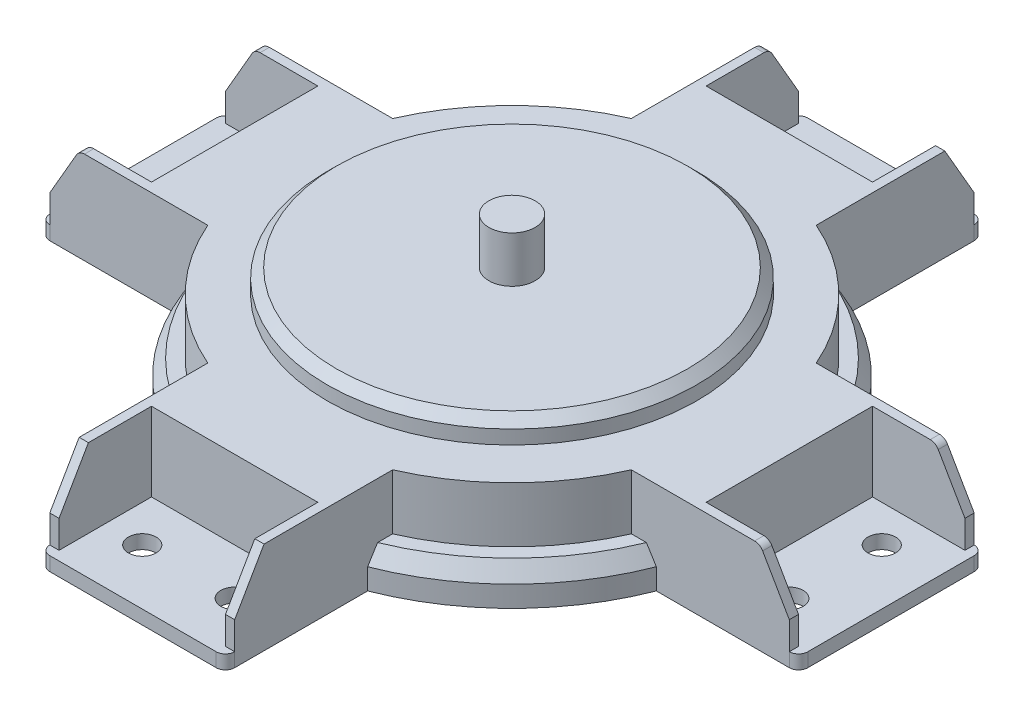
from build123d import *
from OCP.BRepFilletAPI import BRepFilletAPI_MakeChamfer

# Parameters (mm, degrees)
SKETCH5_R            = 250
BOSS_EXTRUDE4_DEPTH  = 100
SKETCH6_W            = 200
SKETCH6_H            = 100
SKETCH6_W_2          = 100
SKETCH6_H_2          = 200
BOSS_EXTRUDE5_DEPTH  = 100
BOSS_EXTRUDE6_DEPTH  = 15
BOSS_EXTRUDE7_DEPTH  = 10
BOSS_EXTRUDE8_DEPTH  = 10
SKETCH18_R           = 15
CUT_EXTRUDE2_DEPTH   = 587.024743505
BOSS_EXTRUDE9_DEPTH  = 10
BOSS_EXTRUDE10_START = -10
BOSS_EXTRUDE10_DEPTH = 10
BOSS_EXTRUDE11_DEPTH = 10
BOSS_EXTRUDE12_DEPTH = 10
SKETCH24_R           = 200
BOSS_EXTRUDE13_DEPTH = 25
SKETCH25_R           = 25
BOSS_EXTRUDE14_DEPTH = 50
BOSS_EXTRUDE15_DEPTH = 40
CHAMFER1_SIZE        = 10
CHAMFER1_SIZE2       = 17.320508076
CHAMFER2_SIZE        = 10


with BuildPart() as part:
    # Sketch5 → Boss-Extrude4 (new body)
    with BuildSketch(Plane(origin=(0, 0, 0), x_dir=(1, 0, 0), z_dir=(0, 1, 0))):
        with Locations(Location((0, 0, 0), (0, 0, 270))):
            Circle(SKETCH5_R)
    extrude(amount=BOSS_EXTRUDE4_DEPTH)

    # Sketch6 → Boss-Extrude5 (add)
    with BuildSketch(Plane(origin=(0, 100, 0), x_dir=(1, 0, 0), z_dir=(0, 1, 0))):
        with Locations((0, -250)):
            Rectangle(SKETCH6_W, SKETCH6_H)
        with Locations((0, 250)):
            Rectangle(SKETCH6_W, SKETCH6_H)
        with Locations((250, 0)):
            Rectangle(SKETCH6_W_2, SKETCH6_H_2)
        with Locations((-250, 0)):
            Rectangle(SKETCH6_W_2, SKETCH6_H_2)
    extrude(amount=-BOSS_EXTRUDE5_DEPTH)

    # Sketch10 → Boss-Extrude6 (add)
    with BuildSketch(Plane.XZ):
        with BuildLine():
            Line((-100, 300), (-100, 400))
            ThreePointArc((-100, 400), (-97.071067812, 407.071067812), (-90, 410))
            Line((-90, 410), (90, 410))
            ThreePointArc((90, 410), (97.071067812, 407.071067812), (100, 400))
            Line((100, 400), (100, 300))
            Line((100, 300), (-100, 300))
        make_face()
        with BuildLine():
            Line((100, -310), (100, -400))
            ThreePointArc((100, -400), (97.071067812, -407.071067812), (90, -410))
            Line((90, -410), (-90, -410))
            ThreePointArc((-90, -410), (-97.071067812, -407.071067812), (-100, -400))
            Line((-100, -400), (-100, -300))
            Line((-100, -300), (90, -300))
            Line((90, -300), (100, -300))
            Line((100, -300), (100, -310))
        make_face()
        with BuildLine():
            Line((-300, -100), (-400, -100))
            ThreePointArc((-400, -100), (-407.071067812, -97.071067812), (-410, -90))
            Line((-410, -90), (-410, 90))
            ThreePointArc((-410, 90), (-407.071067812, 97.071067812), (-400, 100))
            Line((-400, 100), (-300, 100))
            Line((-300, 100), (-300, -100))
        make_face()
        with BuildLine():
            Line((300, -100), (400, -100))
            ThreePointArc((400, -100), (407.071067812, -97.071067812), (410, -90))
            Line((410, -90), (410, 90))
            ThreePointArc((410, 90), (407.071067812, 97.071067812), (400, 100))
            Line((400, 100), (300, 100))
            Line((300, 100), (300, -100))
        make_face()
    extrude(amount=-BOSS_EXTRUDE6_DEPTH)

    # Sketch12 → Boss-Extrude7 (add)
    with BuildSketch(Plane(origin=(100, 0, 0), x_dir=(0, 0, -1), z_dir=(1, 0, 0))):
        Polygon((-400, 15), (-400, 45), (-368.245735195, 100), (-300, 100), (-300, 15), align=None)
    extrude(amount=-BOSS_EXTRUDE7_DEPTH)

    # Sketch13 → Boss-Extrude8 (add)
    with BuildSketch(Plane.ZY.offset(100)):
        Polygon((300, 100), (300, 15), (400, 15), (400, 45), (368.245735195, 100), align=None)
    extrude(amount=-BOSS_EXTRUDE8_DEPTH)

    # Sketch18 → Cut-Extrude2 (cut, through all)
    with BuildSketch(Plane(origin=(0, 15, 0), x_dir=(1, 0, 0), z_dir=(0, 1, 0))):
        with Locations(Location((-50, -350, 0), (0, 0, 270))):
            Circle(SKETCH18_R)
        with Locations(Location((50, -350, 0), (0, 0, 270))):
            Circle(SKETCH18_R)
        with Locations(Location((-350, 50, 0), (0, 0, 270))):
            Circle(SKETCH18_R)
        with Locations(Location((-350, -50, 0), (0, 0, 270))):
            Circle(SKETCH18_R)
        with Locations(Location((-50, 350, 0), (0, 0, 270))):
            Circle(SKETCH18_R)
        with Locations(Location((50, 350, 0), (0, 0, 270))):
            Circle(SKETCH18_R)
        with Locations(Location((350, 50, 0), (0, 0, 270))):
            Circle(SKETCH18_R)
        with Locations(Location((350, -50, 0), (0, 0, 270))):
            Circle(SKETCH18_R)
    extrude(amount=-CUT_EXTRUDE2_DEPTH, mode=Mode.SUBTRACT)

    # Sketch19 → Boss-Extrude9 (add)
    with BuildSketch(Plane.XY.offset(100)):
        with BuildLine():
            Line((-400, 15), (-400, 45))
            Line((-400, 45), (-371.132486541, 95))
            ThreePointArc((-371.132486541, 95), (-367.472232503, 98.660254038), (-362.472232503, 100))
            Line((-362.472232503, 100), (-300, 100))
            Line((-300, 100), (-300, 15))
            Line((-300, 15), (-400, 15))
        make_face()
        with BuildLine():
            Line((400, 15), (400, 45))
            Line((400, 45), (371.132486541, 95))
            ThreePointArc((371.132486541, 95), (367.472232503, 98.660254038), (362.472232503, 100))
            Line((362.472232503, 100), (300, 100))
            Line((300, 100), (300, 15))
            Line((300, 15), (400, 15))
        make_face()
    extrude(amount=-BOSS_EXTRUDE9_DEPTH)

    # Sketch20 → Boss-Extrude10 (add)
    with BuildSketch(Plane(origin=(0, 0, -100), x_dir=(-1, 0, 0), z_dir=(0, 0, -1)).offset(BOSS_EXTRUDE10_START)):
        with BuildLine():
            Line((-400, 15), (-400, 45))
            Line((-400, 45), (-371.132486541, 95))
            ThreePointArc((-371.132486541, 95), (-367.472232503, 98.660254038), (-362.472232503, 100))
            Line((-362.472232503, 100), (-300, 100))
            Line((-300, 100), (-300, 15))
            Line((-300, 15), (-400, 15))
        make_face()
        with BuildLine():
            Line((400, 15), (400, 45))
            Line((400, 45), (371.132486541, 95))
            ThreePointArc((371.132486541, 95), (367.472232503, 98.660254038), (362.472232503, 100))
            Line((362.472232503, 100), (300, 100))
            Line((300, 100), (300, 15))
            Line((300, 15), (400, 15))
        make_face()
    extrude(amount=BOSS_EXTRUDE10_DEPTH)

    # Sketch22 → Boss-Extrude11 (add)
    with BuildSketch(Plane(origin=(100, 0, 0), x_dir=(0, 0, -1), z_dir=(1, 0, 0))):
        Polygon((400, 15), (400, 45), (368.245735195, 100), (300, 100), (300, 15), align=None)
    extrude(amount=-BOSS_EXTRUDE11_DEPTH)

    # Sketch23 → Boss-Extrude12 (add)
    with BuildSketch(Plane.ZY.offset(100)):
        with BuildLine():
            Line((-400, 15), (-400, 45))
            Line((-400, 45), (-371.132486541, 95))
            ThreePointArc((-371.132486541, 95), (-367.472232503, 98.660254038), (-362.472232503, 100))
            Line((-362.472232503, 100), (-300, 100))
            Line((-300, 100), (-300, 15))
            Line((-300, 15), (-400, 15))
        make_face()
    extrude(amount=-BOSS_EXTRUDE12_DEPTH)

    # Sketch24 → Boss-Extrude13 (add)
    with BuildSketch(Plane(origin=(0, 100, 0), x_dir=(1, 0, 0), z_dir=(0, 1, 0))):
        with Locations(Location((0, 0, 0), (0, 0, 270))):
            Circle(SKETCH24_R)
    extrude(amount=BOSS_EXTRUDE13_DEPTH)

    # Sketch25 → Boss-Extrude14 (add)
    with BuildSketch(Plane(origin=(0, 125, 0), x_dir=(1, 0, 0), z_dir=(0, 1, 0))):
        with Locations(Location((0, 0, 0), (0, 0, 270))):
            Circle(SKETCH25_R)
    extrude(amount=BOSS_EXTRUDE14_DEPTH)

    # Sketch27 → Boss-Extrude15 (add)
    with BuildSketch(Plane.XZ):
        with BuildLine():
            Line((-256.173769149, 100), (-229.128784748, 100))
            ThreePointArc((-229.128784748, 100), (-176.776695297, 176.776695297), (-100, 229.128784748))
            Line((-100, 229.128784748), (-100, 256.173769149))
            ThreePointArc((-100, 256.173769149), (-194.454364826, 194.454364826), (-256.173769149, 100))
        make_face()
        with BuildLine():
            Line((100, 229.128784748), (100, 256.173769149))
            ThreePointArc((100, 256.173769149), (194.454364826, 194.454364826), (256.173769149, 100))
            Line((256.173769149, 100), (229.128784748, 100))
            ThreePointArc((229.128784748, 100), (176.776695297, 176.776695297), (100, 229.128784748))
        make_face()
        with BuildLine():
            Line((100, -256.173769149), (100, -229.128784748))
            ThreePointArc((100, -229.128784748), (176.776695297, -176.776695297), (229.128784748, -100))
            Line((229.128784748, -100), (256.173769149, -100))
            ThreePointArc((256.173769149, -100), (194.454364826, -194.454364826), (100, -256.173769149))
        make_face()
        with BuildLine():
            Line((-100, -256.173769149), (-100, -229.128784748))
            ThreePointArc((-100, -229.128784748), (-176.776695297, -176.776695297), (-229.128784748, -100))
            Line((-229.128784748, -100), (-256.173769149, -100))
            ThreePointArc((-256.173769149, -100), (-194.454364826, -194.454364826), (-100, -256.173769149))
        make_face()
    extrude(amount=-BOSS_EXTRUDE15_DEPTH)

    # Chamfer1: one chamfer whose edges measure the first distance from different faces: ONE call of the kernel's chamfer builder (chamfer() names one face for all edges)
    chamfer1_edges_1 = [part.edges().sort_by_distance(p)[0] for p in [
        (194.454364826, 40, -194.454364826),
    ]]
    chamfer1_side_1 = [part.faces().sort_by_distance(p)[0] for p in [
        (181.097571565, 40, -181.097571565),
    ]]
    chamfer1_edges_2 = [part.edges().sort_by_distance(p)[0] for p in [
        (194.454364826, 40, 194.454364826),
    ]]
    chamfer1_side_2 = [part.faces().sort_by_distance(p)[0] for p in [
        (181.097571565, 40, 181.097571565),
    ]]
    chamfer1_edges_3 = [part.edges().sort_by_distance(p)[0] for p in [
        (-194.454364826, 40, 194.454364826),
    ]]
    chamfer1_side_3 = [part.faces().sort_by_distance(p)[0] for p in [
        (-181.097571565, 40, 181.097571565),
    ]]
    chamfer1_edges_4 = [part.edges().sort_by_distance(p)[0] for p in [
        (-194.454364826, 40, -194.454364826),
    ]]
    chamfer1_side_4 = [part.faces().sort_by_distance(p)[0] for p in [
        (-181.097571565, 40, -181.097571565),
    ]]
    chamfer1 = BRepFilletAPI_MakeChamfer(part.part.solid().wrapped)
    for e in chamfer1_edges_1:
        chamfer1.Add(CHAMFER1_SIZE, CHAMFER1_SIZE2, e.wrapped, chamfer1_side_1[0].wrapped)  # the first distance lies on this face
    for e in chamfer1_edges_2:
        chamfer1.Add(CHAMFER1_SIZE, CHAMFER1_SIZE2, e.wrapped, chamfer1_side_2[0].wrapped)  # the first distance lies on this face
    for e in chamfer1_edges_3:
        chamfer1.Add(CHAMFER1_SIZE, CHAMFER1_SIZE2, e.wrapped, chamfer1_side_3[0].wrapped)  # the first distance lies on this face
    for e in chamfer1_edges_4:
        chamfer1.Add(CHAMFER1_SIZE, CHAMFER1_SIZE2, e.wrapped, chamfer1_side_4[0].wrapped)  # the first distance lies on this face
    add(Compound.cast(chamfer1.Shape()), mode=Mode.REPLACE)

    # Chamfer2
    chamfer2_edges = [part.edges().sort_by_distance(p)[0] for p in [
        (0, 125, -200),
    ]]
    chamfer(chamfer2_edges, length=CHAMFER2_SIZE)


solid = part.part
